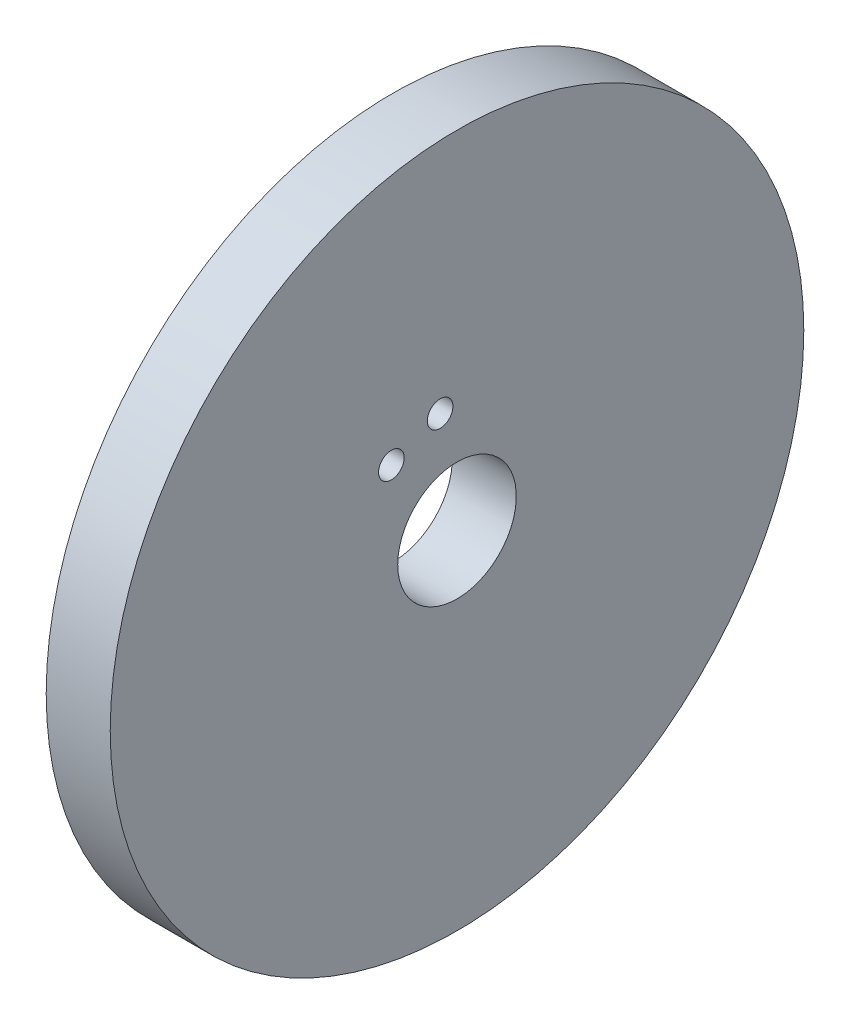
from build123d import *

# Parameters (mm, degrees)
AXIAL_PROFILE_MM_W     = 12
AXIAL_PROFILE_MM_H     = 53.8875
AXIAL_HOLES_DEPTH      = 96.448886845
AXIAL_HOLES_DEPTH_BACK = 96.448886845
SKETCH2_R              = 2.4


with BuildPart() as part:
    # Axial profile (mm) → Full revolution (revolve)
    with BuildSketch(Plane.XY, mode=Mode.PRIVATE) as full_revolution_sk:
        with Locations((19.7, 38.05625)):
            Rectangle(AXIAL_PROFILE_MM_W, AXIAL_PROFILE_MM_H)
    revolve(full_revolution_sk.sketch.rotate(Axis((-110, 0, 0), (1, 0, 0)), 90), axis=Axis((-110, 0, 0), (1, 0, 0)))

    # Sketch2 → Axial holes (cut, two sides: drawn at the far end of the back side and taken through both)
    with BuildSketch(Plane(origin=(0, 0, 0), x_dir=(0, 0, -1), z_dir=(1, 0, 0)).offset(-AXIAL_HOLES_DEPTH_BACK)):
        with Locations((-3.163812264, 20.557973926)):
            Circle(SKETCH2_R)
        with Locations((-12.299529665, 16.773835877)):
            Circle(SKETCH2_R)
    extrude(amount=AXIAL_HOLES_DEPTH + AXIAL_HOLES_DEPTH_BACK, mode=Mode.SUBTRACT)


solid = part.part
